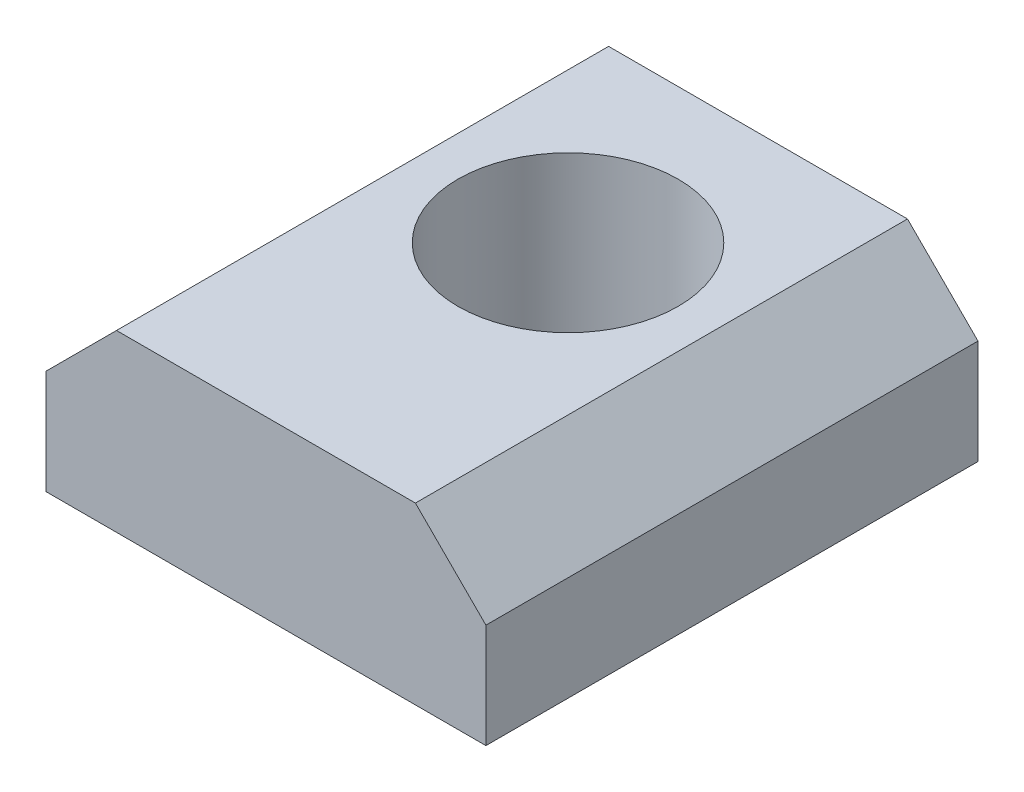
from build123d import *

# Parameters (mm, degrees)
SKETCH1_W                          = 15.8496
SKETCH1_H                          = 6.2992
BASE_EXTRUDE_DEPTH                 = 17.7292
F_5_16_18_TAPPED_HOLE1_D           = 6.5278
F_5_16_18_TAPPED_HOLE1_CBORE_D     = 7.9375
F_5_16_18_TAPPED_HOLE1_CBORE_DEPTH = 15.875
CHAMFER1_SIZE                      = 2.54


with BuildPart() as part:
    # Sketch1 → Base-Extrude (new body)
    with BuildSketch(Plane.XY):
        with Locations((7.9248, 3.1496)):
            Rectangle(SKETCH1_W, SKETCH1_H)
    extrude(amount=-BASE_EXTRUDE_DEPTH)

    # 5/16-18 Tapped Hole1 (through all)
    with Locations(Plane(origin=(0, 6.2992, 0), x_dir=(-1, 0, 0), z_dir=(0, 1, 0))):
        with Locations((-7.9375, -10.8712)):
            CounterBoreHole(F_5_16_18_TAPPED_HOLE1_D / 2, F_5_16_18_TAPPED_HOLE1_CBORE_D / 2, F_5_16_18_TAPPED_HOLE1_CBORE_DEPTH)

    # Chamfer1
    chamfer1_edges = [part.edges().sort_by_distance(p)[0] for p in [
        (0, 6.2992, -8.8646),
        (15.8496, 6.2992, -8.8646),
    ]]
    chamfer(chamfer1_edges, length=CHAMFER1_SIZE)


solid = part.part
